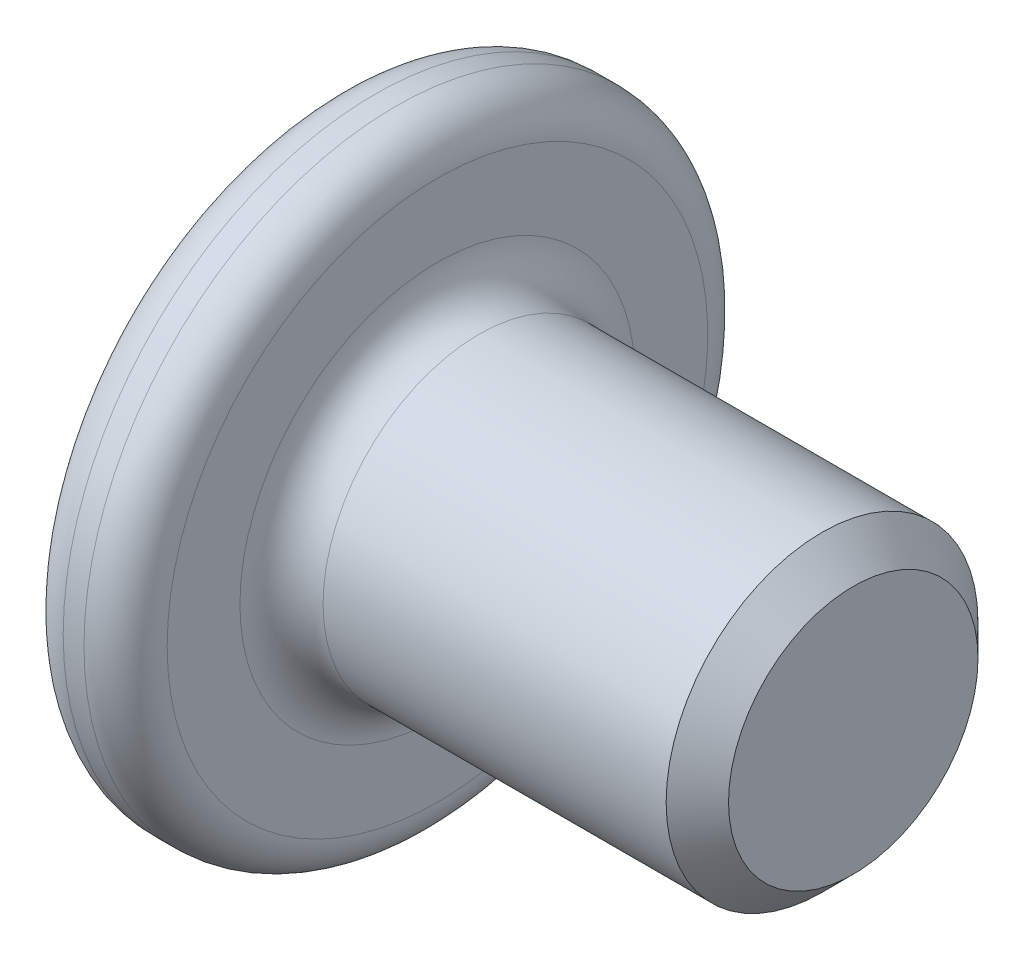
from build123d import *

# Parameters (mm, degrees)
FILLET_1_R          = 0.4
CUT_EXTRUDE_1_DEPTH = 0.5
CHAMFER_1_SIZE      = 0.3


with BuildPart() as part:
    # Эскиз1 → Повернуть1 (revolve)
    with BuildSketch(Plane.XY, mode=Mode.PRIVATE) as revolve_1_sk:
        Polygon((0, 0), (0, 3), (1, 3), (1, 1.5), (5, 1.5), (5, 0), align=None)
    revolve(revolve_1_sk.sketch.rotate(Axis((-40.588436676, 0, 0), (1, 0, 0)), 90), axis=Axis((-40.588436676, 0, 0), (1, 0, 0)))

    # Скругление1
    fillet_1_edges = [part.edges().sort_by_distance(p)[0] for p in [
        (1, 0, -1.5),
        (1, 0, -3),
        (0, 0, -3),
    ]]
    fillet(fillet_1_edges, radius=FILLET_1_R)

    # Эскиз2 → Вырез-Вытянуть1 (cut)
    with BuildSketch(Plane.ZY):
        Polygon((0.2, -2), (-0.2, -2), (-0.2, -0.2), (-2, -0.2), (-2, 0.2), (-0.2, 0.2), (-0.2, 2), (0.2, 2), (0.2, 0.2), (2, 0.2), (2, -0.2), (0.2, -0.2), align=None)
    extrude(amount=-CUT_EXTRUDE_1_DEPTH, mode=Mode.SUBTRACT)

    # Фаска1
    chamfer_1_edges = [part.edges().sort_by_distance(p)[0] for p in [
        (5, 0, -1.5),
    ]]
    chamfer(chamfer_1_edges, length=CHAMFER_1_SIZE)


solid = part.part
